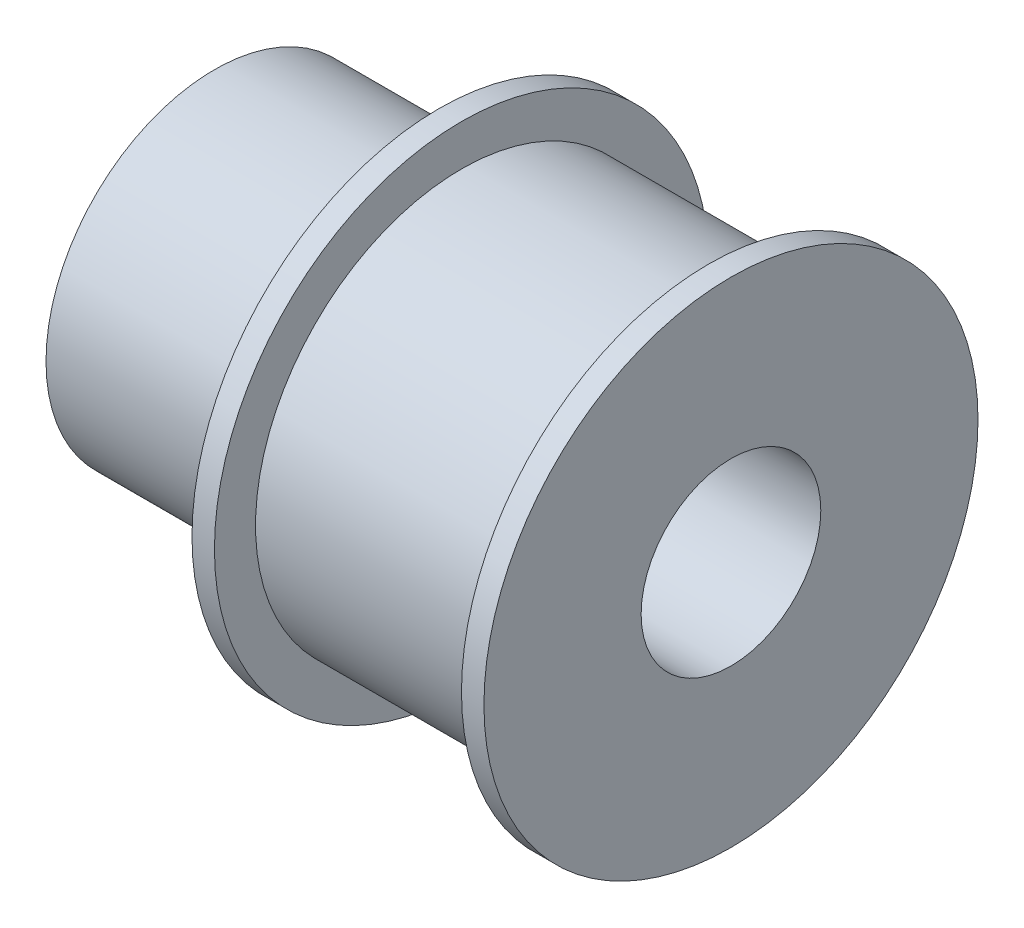
from build123d import *

# Parameters (mm, degrees)
SKETCH_1_R          = 11
EXTRUDE_1_DEPTH     = 13
SKETCH_2_R          = 11
SKETCH_2_R_2        = 9.17
CUT_EXTRUDE_1_DEPTH = 5.5
SKETCH_3_R          = 7.5
EXTRUDE_2_DEPTH     = 10
CUT_EXTRUDE_2_REACH = 29.767
SKETCH_4_R          = 4


with BuildPart() as part:
    # 草图1 → 凸台-拉伸1 (new body)
    with BuildSketch(Plane(origin=(0, 0, 0), x_dir=(0, 0, -1), z_dir=(1, 0, 0))):
        with Locations(Location((0, 0, 0), (0, 0, 180))):
            Circle(SKETCH_1_R)
    extrude(amount=EXTRUDE_1_DEPTH)

    # 草图2 → 切除-拉伸1 (cut, symmetric)
    with BuildSketch(Plane(origin=(6.5, 0, 0), x_dir=(0, 0, -1), z_dir=(1, 0, 0))):
        with Locations(Location((0, 0, 0), (0, 0, 180))):
            Circle(SKETCH_2_R)
        Circle(SKETCH_2_R_2, mode=Mode.SUBTRACT)
    extrude(amount=CUT_EXTRUDE_1_DEPTH, both=True, mode=Mode.SUBTRACT)

    # 草图3 → 凸台-拉伸2 (add)
    with BuildSketch(Plane.ZY):
        Circle(SKETCH_3_R)
    extrude(amount=EXTRUDE_2_DEPTH)

    # 草图4 → 切除-拉伸2 (cut, up to next)
    with BuildSketch(Plane.ZY.offset(10), mode=Mode.PRIVATE) as cut_extrude_2_sk1:
        Circle(SKETCH_4_R)
    cut_extrude_2_tool1 = extrude(cut_extrude_2_sk1.sketch, amount=-CUT_EXTRUDE_2_REACH, mode=Mode.PRIVATE) & part.part
    add(cut_extrude_2_tool1.solids().sort_by_distance((-10, 0, 0))[0], mode=Mode.SUBTRACT)


solid = part.part
